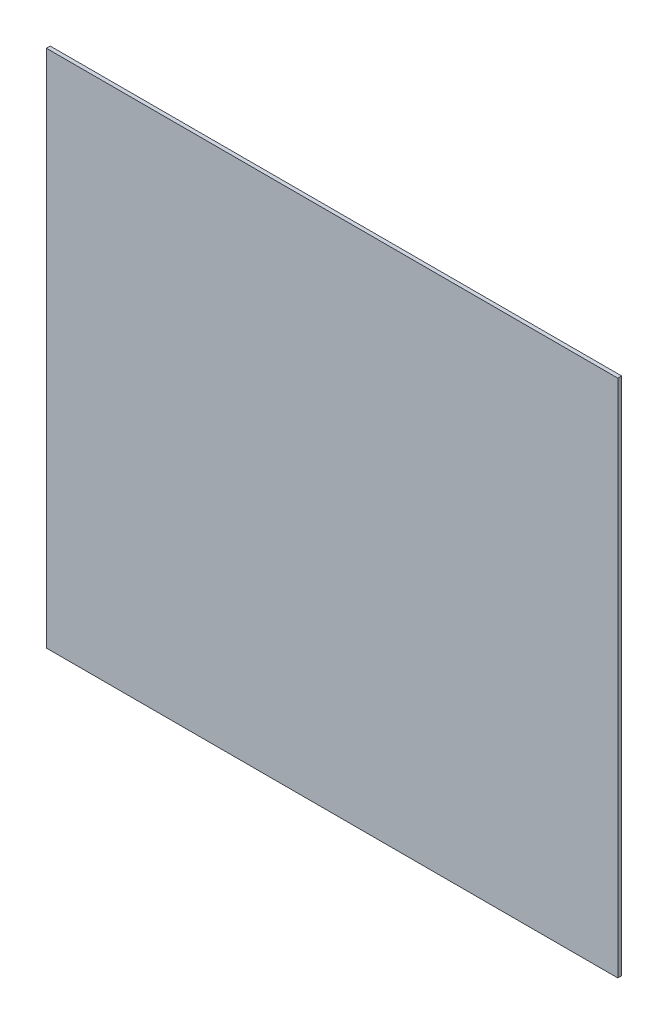
from build123d import *

# Parameters (mm, degrees)
SKETCH1_W           = 11
SKETCH1_H           = 10
BOSS_EXTRUDE1_DEPTH = 0.07366


with BuildPart() as part:
    # Sketch1 → Boss-Extrude1 (new body)
    with BuildSketch(Plane.XY):
        with Locations((5.5, 0)):
            Rectangle(SKETCH1_W, SKETCH1_H)
    extrude(amount=BOSS_EXTRUDE1_DEPTH)


solid = part.part
